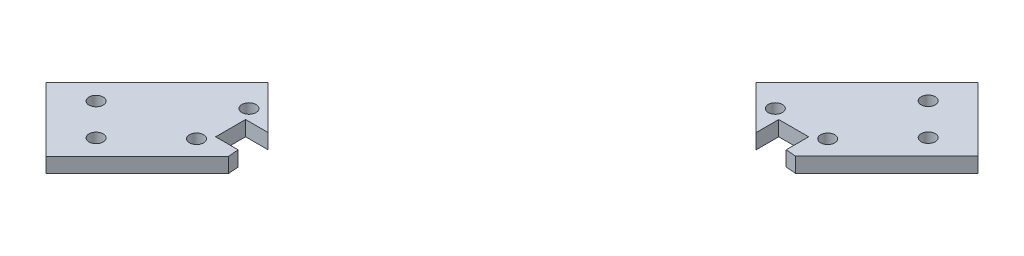
from build123d import *

# Parameters (mm, degrees)
SKETCH1_R           = 1.5
SKETCH1_R_2         = 55
BOSS_EXTRUDE1_DEPTH = 3.175
CUT_EXTRUDE3_DEPTH  = 140.736059076
CUT_EXTRUDE4_START  = -10
SKETCH3_R           = 1.5
CUT_EXTRUDE4_DEPTH  = 10
CUT_EXTRUDE5_DEPTH  = 140.736059076
CUT_EXTRUDE6_DEPTH  = 140.736059076
SKETCH6_R           = 1.5
CUT_EXTRUDE7_DEPTH  = 124.953233311


with BuildPart() as part:
    # Sketch1 → Boss-Extrude1 (new body)
    with BuildSketch(Plane(origin=(0, 0, 0), x_dir=(1, 0, 0), z_dir=(0, 1, 0))):
        Polygon((0.047005036, -98.782806148), (-98.782806148, -0.047005036), (-0.047005036, 98.782806148), (98.782806148, 0.047005036), align=None)
        with Locations(Location((-61.346730494, 5.55625, 0), (0, 0, 270))):
            Circle(SKETCH1_R, mode=Mode.SUBTRACT)
        with Locations(Location((-61.346730494, -5.55625, 0), (0, 0, 270))):
            Circle(SKETCH1_R, mode=Mode.SUBTRACT)
        with Locations(Location((-5.55625, -61.346730494, 0), (0, 0, 270))):
            Circle(SKETCH1_R, mode=Mode.SUBTRACT)
        with Locations(Location((5.55625, -61.346730494, 0), (0, 0, 270))):
            Circle(SKETCH1_R, mode=Mode.SUBTRACT)
        with Locations(Location((61.346730494, -5.55625, 0), (0, 0, 270))):
            Circle(SKETCH1_R, mode=Mode.SUBTRACT)
        with Locations(Location((61.346730494, 5.55625, 0), (0, 0, 270))):
            Circle(SKETCH1_R, mode=Mode.SUBTRACT)
        with Locations(Location((5.55625, 61.346730494, 0), (0, 0, 270))):
            Circle(SKETCH1_R, mode=Mode.SUBTRACT)
        with Locations(Location((-5.55625, 61.346730494, 0), (0, 0, 270))):
            Circle(SKETCH1_R, mode=Mode.SUBTRACT)
        with Locations(Location((0, 0, 0), (0, 0, 270))):
            Circle(SKETCH1_R_2, mode=Mode.SUBTRACT)
    extrude(amount=BOSS_EXTRUDE1_DEPTH)

    # Sketch2 → Cut-Extrude3 (cut, through all)
    with BuildSketch(Plane(origin=(0, 3.175, 0), x_dir=(1, 0, 0), z_dir=(0, 1, 0))):
        Polygon((3.175, 53.34), (3.175, 59.69), (-3.175, 59.69), (-3.175, 53.34), (-3.175, 52.244537665), (3.175, 52.244537665), align=None)
        Polygon((53.34, -3.175), (59.69, -3.175), (59.69, 3.175), (53.34, 3.175), (52.244537665, 3.175), (52.244537665, -3.175), align=None)
        Polygon((-3.175, -53.34), (-3.175, -59.69), (3.175, -59.69), (3.175, -53.34), (3.175, -52.244537665), (-3.175, -52.244537665), align=None)
        Polygon((-53.34, 3.175), (-59.69, 3.175), (-59.69, -3.175), (-53.34, -3.175), (-52.244537665, -3.175), (-52.244537665, 3.175), align=None)
    extrude(amount=-CUT_EXTRUDE3_DEPTH, mode=Mode.SUBTRACT)

    # Sketch3 → Cut-Extrude4 (cut)
    # profile 1 of 3: a face of its own
    with BuildSketch(Plane(origin=(0, 3.175, 0), x_dir=(1, 0, 0), z_dir=(0, 1, 0)).offset(CUT_EXTRUDE4_START)):
        with BuildLine():
            Line((38.872362643, 38.909374482), (49.367900556, 49.414905592))
            Line((49.367900556, 49.414905592), (24.66044776, 74.09885587))
            Line((24.66044776, 74.09885587), (5.321919094, 54.741914263))
            ThreePointArc((5.321919094, 54.741914263), (23.472344653, 49.739813394), (38.872362643, 38.909374482))
        make_face()
    # profile 2 of 3: a face of its own
    with BuildSketch(Plane(origin=(0, 3.175, 0), x_dir=(1, 0, 0), z_dir=(0, 1, 0)).offset(CUT_EXTRUDE4_START)):
        with BuildLine():
            Line((-49.367900556, -49.414905592), (-38.872362643, -38.909374482))
            ThreePointArc((-38.872362643, -38.909374482), (-49.717452606, -23.519670626), (-54.736824686, -5.374013707))
            Line((-54.736824686, -5.374013707), (-74.075353352, -24.730955314))
            Line((-74.075353352, -24.730955314), (-49.367900556, -49.414905592))
        make_face()
    # profile 3 of 3: a face of its own
    with BuildSketch(Plane(origin=(0, 3.175, 0), x_dir=(1, 0, 0), z_dir=(0, 1, 0)).offset(CUT_EXTRUDE4_START)):
        with BuildLine():
            Line((98.782806148, 0.047005036), (49.367900556, 49.414905592))
            Line((49.367900556, 49.414905592), (38.872362643, 38.909374482))
            ThreePointArc((38.872362643, 38.909374482), (50.179066182, 22.518022052), (54.908281479, 3.175))
            Line((54.908281479, 3.175), (59.69, 3.175))
            Line((59.69, 3.175), (59.69, -3.175))
            Line((59.69, -3.175), (54.908281479, -3.175))
            ThreePointArc((54.908281479, -3.175), (38.890872965, -38.890872965), (3.175, -54.908281479))
            Line((3.175, -54.908281479), (3.175, -59.69))
            Line((3.175, -59.69), (-3.175, -59.69))
            Line((-3.175, -59.69), (-3.175, -54.908281479))
            ThreePointArc((-3.175, -54.908281479), (-22.494142184, -50.189775527), (-38.872362643, -38.909374482))
            Line((-38.872362643, -38.909374482), (-49.367900556, -49.414905592))
            Line((-49.367900556, -49.414905592), (0.047005036, -98.782806148))
            Line((0.047005036, -98.782806148), (98.782806148, 0.047005036))
        make_face()
        with Locations((-5.55625, -61.346730494)):
            Circle(SKETCH3_R, mode=Mode.SUBTRACT)
        with Locations((5.55625, -61.346730494)):
            Circle(SKETCH3_R, mode=Mode.SUBTRACT)
        with Locations((61.346730494, -5.55625)):
            Circle(SKETCH3_R, mode=Mode.SUBTRACT)
        with Locations((61.346730494, 5.55625)):
            Circle(SKETCH3_R, mode=Mode.SUBTRACT)
    extrude(amount=CUT_EXTRUDE4_DEPTH, mode=Mode.SUBTRACT)

    # Sketch4 → Cut-Extrude5 (cut, through all)
    with BuildSketch(Plane(origin=(0, 3.175, 0), x_dir=(1, 0, 0), z_dir=(0, 1, 0))):
        Polygon((-54.908281479, 3.175), (-75.255419375, 23.502783048), (-23.546766486, 75.260669691), (-3.175, 54.908281479), align=None)
    extrude(amount=-CUT_EXTRUDE5_DEPTH, mode=Mode.SUBTRACT)


with BuildPart() as cut_extrude5_piece_1:
    # of the separate pieces the step leaves, piece 1, a body of its own (cut_extrude5_pieces)
    add(part.part.solids().sort_by_distance((-74.075353352, 0, 24.730955314))[0])


with BuildPart() as cut_extrude5_piece_2:
    # of the separate pieces the step leaves, piece 2, a body of its own (cut_extrude5_pieces)
    add(part.part.solids().sort_by_distance((-3.175, 0, -54.908281479))[0])


with BuildPart() as cut_extrude6_tool:
    # Sketch5 → Cut-Extrude6 (new, through all)
    with BuildSketch(Plane(origin=(0, 3.175, 0), x_dir=(1, 0, 0), z_dir=(0, 1, 0))):
        Polygon((-0.047005036, 98.782806148), (11.121699276, 87.624725864), (-87.614101836, -11.205085321), (-98.782806148, -0.047005036), align=None)
    extrude(amount=-CUT_EXTRUDE6_DEPTH)


with BuildPart() as cut_extrude5_piece_1_1:
    add(cut_extrude5_piece_1.part)

    # Cut-Extrude6: cut by cut_extrude6_tool
    add(cut_extrude6_tool.part, mode=Mode.SUBTRACT)


with BuildPart() as cut_extrude5_piece_2_1:
    add(cut_extrude5_piece_2.part)

    # Cut-Extrude6: cut by cut_extrude6_tool
    add(cut_extrude6_tool.part, mode=Mode.SUBTRACT)


with BuildPart() as cut_extrude7_tool:
    # Sketch6 → Cut-Extrude7 (new, through all)
    with BuildSketch(Plane(origin=(0, 3.175, 0), x_dir=(1, 0, 0), z_dir=(0, 1, 0))):
        with BuildLine():
            ThreePointArc((-73.220428508, -14.983508678), (-73.219419094, -17.104828781), (-71.09809899, -17.103819368))
            Line((-71.09809899, -17.103819368), (-73.220428508, -14.983508678))
        make_face()
        with BuildLine():
            Line((-73.220428508, -14.983508678), (-71.09809899, -17.103819368))
            ThreePointArc((-71.09809899, -17.103819368), (-70.773307917, -16.617359439), (-70.659263749, -16.043664023))
            ThreePointArc((-70.659263749, -16.043664023), (-71.585568332, -14.657708191), (-73.220428508, -14.983508678))
        make_face()
        with BuildLine():
            ThreePointArc((-79.989802749, -8.220573681), (-79.988793336, -10.341893785), (-77.867473232, -10.340884371))
            Line((-77.867473232, -10.340884371), (-79.989802749, -8.220573681))
        make_face()
        with BuildLine():
            Line((-79.989802749, -8.220573681), (-77.867473232, -10.340884371))
            ThreePointArc((-77.867473232, -10.340884371), (-77.542682159, -9.854424443), (-77.428637991, -9.280729026))
            ThreePointArc((-77.428637991, -9.280729026), (-78.354942574, -7.894773194), (-79.989802749, -8.220573681))
        make_face()
        with Locations(Location((16.002609239, 72.202151202, 0), (0, 0, 270))):
            Circle(SKETCH6_R)
        with Locations(Location((9.233234997, 78.965086199, 0), (0, 0, 270))):
            Circle(SKETCH6_R)
    extrude(amount=-CUT_EXTRUDE7_DEPTH)


with BuildPart() as cut_extrude5_piece_1_2:
    add(cut_extrude5_piece_1_1.part)

    # Cut-Extrude7: cut by cut_extrude7_tool
    add(cut_extrude7_tool.part, mode=Mode.SUBTRACT)


with BuildPart() as cut_extrude5_piece_2_2:
    add(cut_extrude5_piece_2_1.part)

    # Cut-Extrude7: cut by cut_extrude7_tool
    add(cut_extrude7_tool.part, mode=Mode.SUBTRACT)


solid = Compound([cut_extrude5_piece_1_2.part, cut_extrude5_piece_2_2.part])
